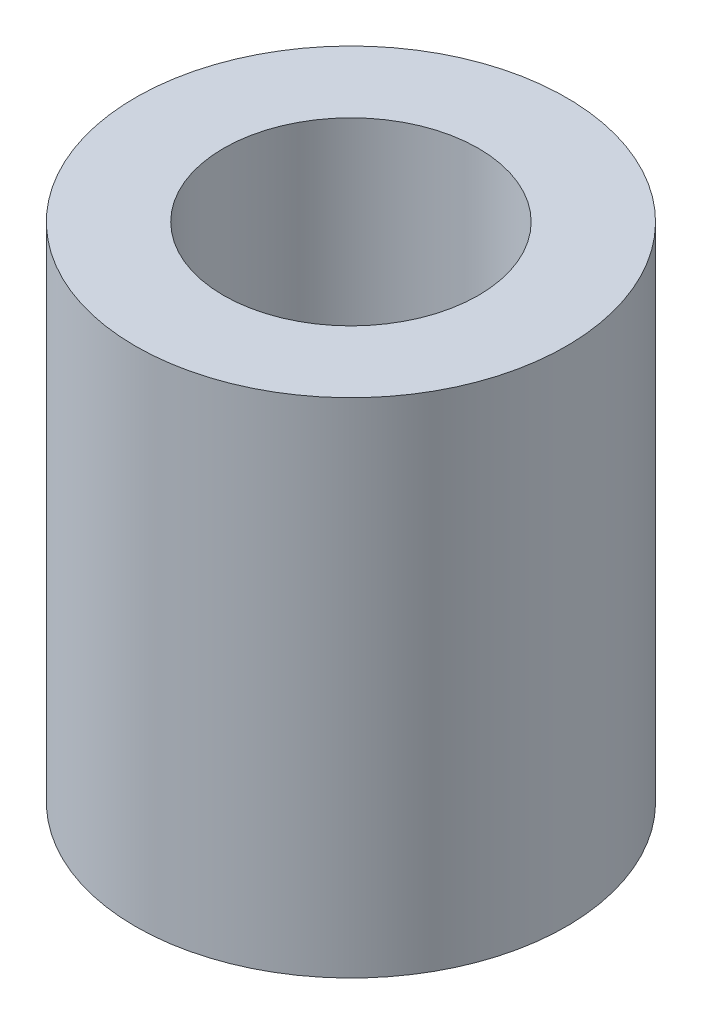
from build123d import *

# Parameters (mm, degrees)
SKETCH2_R           = 3
BOSS_EXTRUDE1_DEPTH = 7
SKETCH3_R           = 1.775
CUT_EXTRUDE1_DEPTH  = 9.185352772


with BuildPart() as part:
    # Sketch2 → Boss-Extrude1 (new body)
    with BuildSketch(Plane(origin=(0, 0, 0), x_dir=(1, 0, 0), z_dir=(0, 1, 0))):
        with Locations(Location((0, 0, 0), (0, 0, 270))):
            Circle(SKETCH2_R)
    extrude(amount=BOSS_EXTRUDE1_DEPTH)

    # Sketch3 → Cut-Extrude1 (cut, through all)
    with BuildSketch(Plane(origin=(0, 7, 0), x_dir=(1, 0, 0), z_dir=(0, 1, 0))):
        with Locations(Location((0, 0, 0), (0, 0, 270))):
            Circle(SKETCH3_R)
    extrude(amount=-CUT_EXTRUDE1_DEPTH, mode=Mode.SUBTRACT)


solid = part.part
